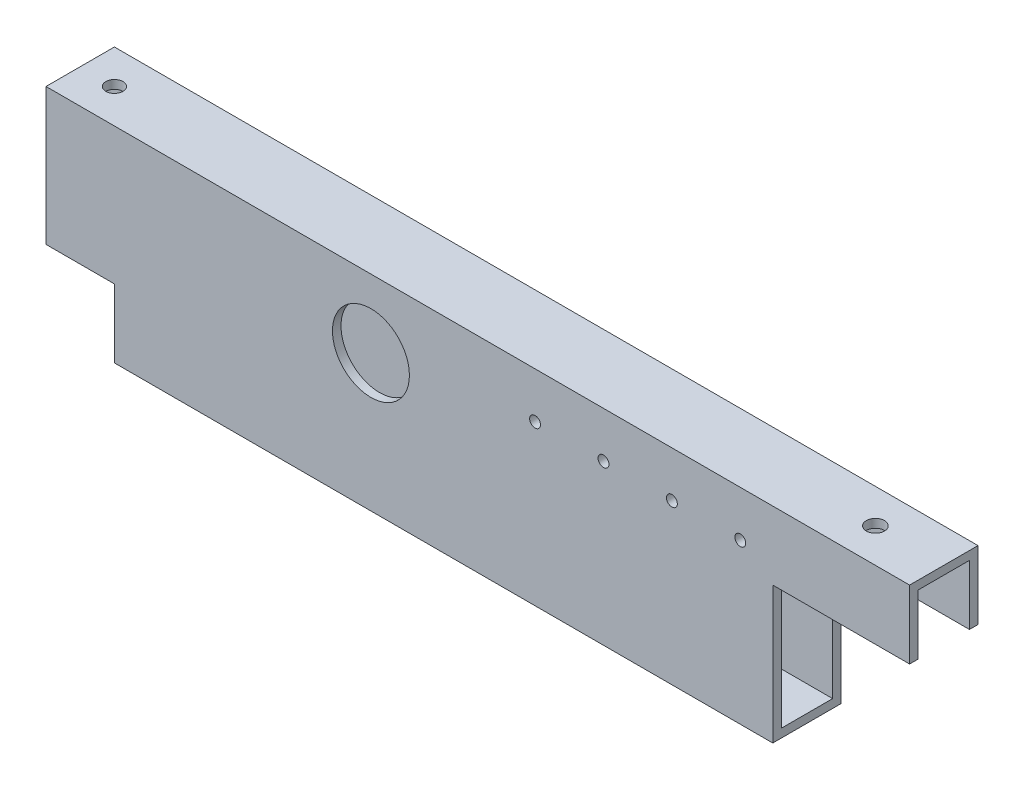
from build123d import *

# Parameters (mm, degrees)
BOSS_EXTRUDE1_DEPTH         = 12.7
F_1_4_0_25_DIAMETER_HOLE1_D = 6.35
CUT_EXTRUDE1_DEPTH          = 580.243923145
SKETCH8_R                   = 14.2875
CUT_EXTRUDE2_DEPTH          = 293.531067795
F_10_32_TAPPED_HOLE1_D      = 4.0386
F_10_32_TAPPED_HOLE1_DEPTH  = 13.716
F_10_32_TAPPED_HOLE1_TIP    = 1.213317848
SKETCH11_W                  = 257.175
SKETCH11_H                  = 76.2
CUT_EXTRUDE3_DEPTH          = 293.531067795
SKETCH13_W                  = 50.8
SKETCH13_H                  = 50.8
CUT_EXTRUDE5_DEPTH          = 293.531067795
F_1_4_CLEARANCE_HOLE1_D     = 6.7564


with BuildPart() as part:
    # Sketch1 → Boss-Extrude1 (new, symmetric)
    with BuildSketch(Plane.XY):
        Polygon((-288.925, 38.1), (-288.925, -12.7), (-263.525, -12.7), (-263.525, -38.1), (263.525, -38.1), (263.525, -12.7), (288.925, -12.7), (288.925, 38.1), align=None)
    extrude(amount=BOSS_EXTRUDE1_DEPTH, both=True)

    # 1/4 (0.25) Diameter Hole1 (through all)
    with Locations(Plane(origin=(0, 38.1, 0), x_dir=(1, 0, 0), z_dir=(0, 1, 0))):
        with Locations((-276.225, 0), (276.225, 0)):
            Hole(F_1_4_0_25_DIAMETER_HOLE1_D / 2)

    # Sketch5 → Cut-Extrude1 (cut, through all)
    with BuildSketch(Plane(origin=(288.925, 0, 0), x_dir=(0, 0, -1), z_dir=(1, 0, 0))):
        Polygon((9.525, -12.7), (9.525, 34.925), (-9.525, 34.925), (-9.525, -12.7), (-9.525, -34.925), (9.525, -34.925), align=None)
    extrude(amount=-CUT_EXTRUDE1_DEPTH, mode=Mode.SUBTRACT)

    # Sketch8 → Cut-Extrude2 (cut, through all)
    with BuildSketch(Plane.XY.offset(12.7)):
        with Locations((-168.275, 12.7)):
            Circle(SKETCH8_R)
        with Locations((168.275, 12.7)):
            Circle(SKETCH8_R)
    extrude(amount=-CUT_EXTRUDE2_DEPTH, mode=Mode.SUBTRACT)

    # #10-32 Tapped Hole1
    with Locations(Plane.XY.offset(12.7)):
        with Locations((-107.315, 21.082), (-81.915, 21.082), (-56.515, 21.082), (-31.115, 21.082)):
            Hole(F_10_32_TAPPED_HOLE1_D / 2, depth=F_10_32_TAPPED_HOLE1_DEPTH)
            with Locations((0, 0, -(F_10_32_TAPPED_HOLE1_DEPTH + F_10_32_TAPPED_HOLE1_TIP / 2))):  # 118° drill point
                Cone(0, F_10_32_TAPPED_HOLE1_D / 2, F_10_32_TAPPED_HOLE1_TIP, mode=Mode.SUBTRACT)

    # Sketch11 → Cut-Extrude3 (cut, through all)
    with BuildSketch(Plane.XY.offset(12.7)):
        with Locations((160.3375, 0)):
            Rectangle(SKETCH11_W, SKETCH11_H)
    extrude(amount=-CUT_EXTRUDE3_DEPTH, mode=Mode.SUBTRACT)

    # Sketch13 → Cut-Extrude5 (cut, through all)
    with BuildSketch(Plane.XY.offset(12.7)):
        with Locations((6.35, -12.7)):
            Rectangle(SKETCH13_W, SKETCH13_H)
    extrude(amount=-CUT_EXTRUDE5_DEPTH, mode=Mode.SUBTRACT)

    # 1/4 Clearance Hole1 (through all)
    with Locations(Plane(origin=(0, 38.1, 0), x_dir=(1, 0, 0), z_dir=(0, 1, 0))):
        with Locations((6.35, 0)):
            Hole(F_1_4_CLEARANCE_HOLE1_D / 2)


solid = part.part
